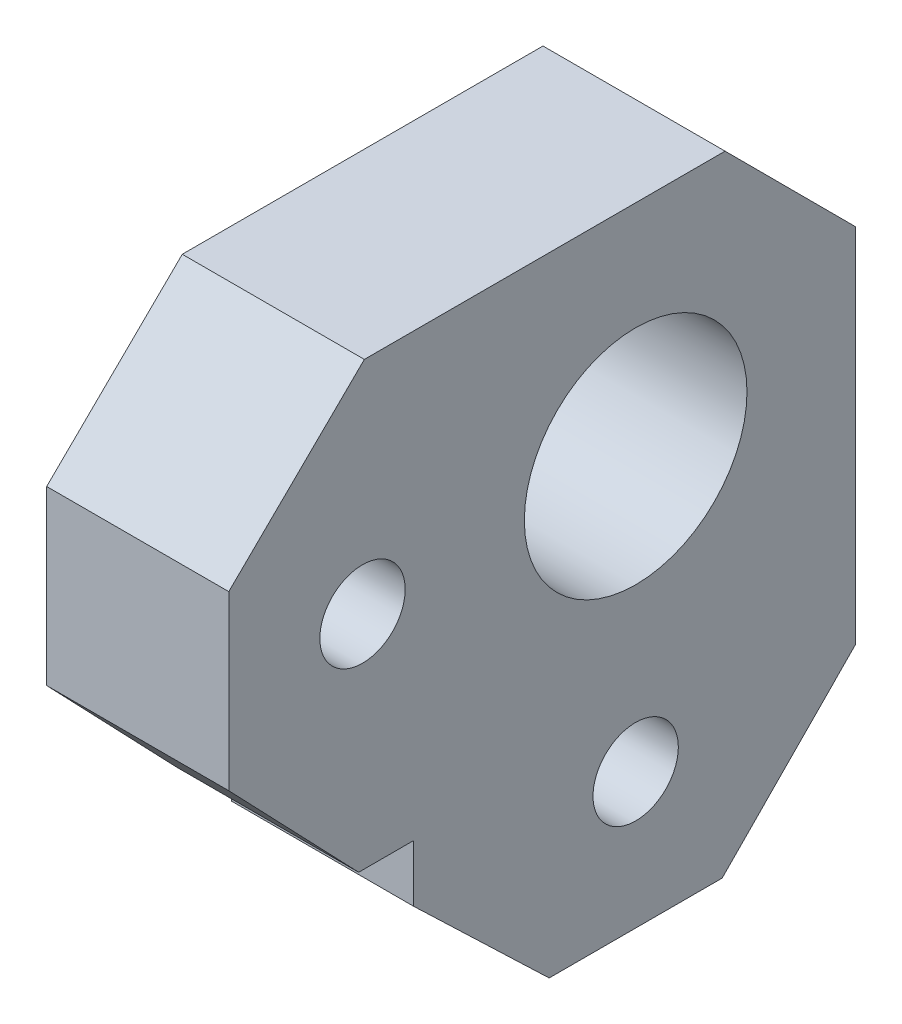
from build123d import *

# Parameters (mm, degrees)
SKETCH1_R           = 3.9125
SKETCH1_R_2         = 1.5
BOSS_EXTRUDE1_DEPTH = 6.4
SKETCH2_W           = 1
SKETCH2_H           = 1
CUT_EXTRUDE1_DEPTH  = 0.01


with BuildPart() as part:
    # Sketch1 → Boss-Extrude1 (new body)
    with BuildSketch(Plane(origin=(0, 0, 0), x_dir=(0, 0, -1), z_dir=(1, 0, 0))):
        Polygon((9.255332298, -5.831457087), (4.574493559, -10.592295826), (-1.503828964, -10.592295826), (-6.264667702, -6.031457087), (-6.264667702, -4.026426966), (-8.199461444, -4.026426966), (-12.764667702, 0.738779293), (-12.764667702, 6.798306532), (-7.999461444, 11.483512791), (4.678092816, 11.483512791), (9.255332298, 6.898567055), align=None)
        with Locations((1.535332298, 3.768542913)):
            Circle(SKETCH1_R, mode=Mode.SUBTRACT)
        with Locations((-8.064667702, 3.768542913)):
            Circle(SKETCH1_R_2, mode=Mode.SUBTRACT)
        with Locations((1.535332298, -5.831457087)):
            Circle(SKETCH1_R_2, mode=Mode.SUBTRACT)
    extrude(amount=BOSS_EXTRUDE1_DEPTH)

    # Sketch2 → Cut-Extrude1 (cut)
    with BuildSketch(Plane.ZY):
        with Locations((4.264667702, -2.026426966)):
            Rectangle(SKETCH2_W, SKETCH2_H)
    extrude(amount=-CUT_EXTRUDE1_DEPTH, mode=Mode.SUBTRACT)


solid = part.part
